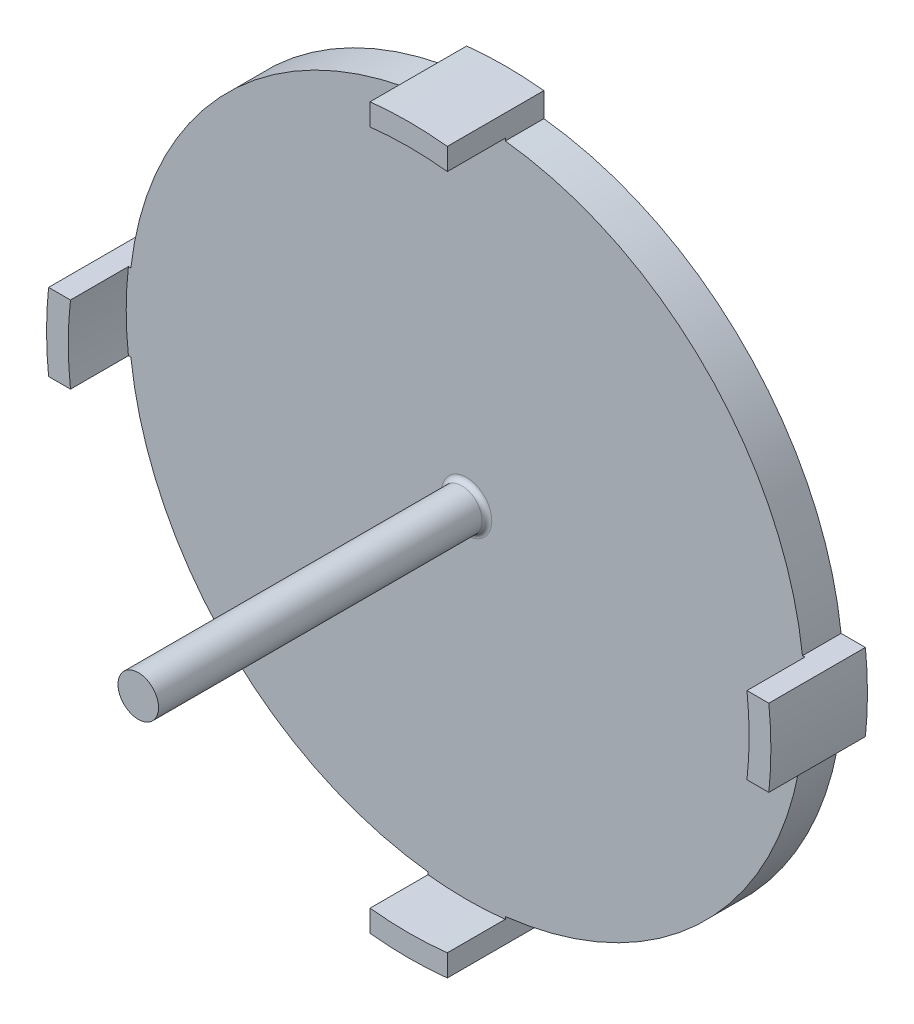
from build123d import *

# Parameters (mm, degrees)
BOSS_EXTRUDE1_DEPTH   = 10
BOSS_EXTRUDE1_2_DEPTH = 10
BOSS_EXTRUDE1_3_DEPTH = 10
BOSS_EXTRUDE1_4_DEPTH = 10
BOSS_EXTRUDE2_DEPTH   = 4
SKETCH3_R             = 2.1
BOSS_EXTRUDE3_DEPTH   = 34
FILLET1_R             = 0.5


with BuildPart() as part:
    # Sketch1 → Boss-Extrude1 (new body)
    with BuildSketch(Plane.XY):
        with BuildLine():
            ThreePointArc((37.286056375, -4), (37.5, 0), (37.286056375, 4))
            Line((37.286056375, 4), (35.022314315, 4))
            ThreePointArc((35.022314315, 4), (35.25, 0), (35.022314315, -4))
            Line((35.022314315, -4), (37.286056375, -4))
        make_face()
    extrude(amount=BOSS_EXTRUDE1_DEPTH)



with BuildPart() as body_2:
    # Sketch1 → Boss-Extrude1 2 (new body)
    with BuildSketch(Plane.XY):
        with BuildLine():
            ThreePointArc((-4, 35.022314315), (0, 35.25), (4, 35.022314315))
            Line((4, 35.022314315), (4, 37.286056375))
            ThreePointArc((4, 37.286056375), (0, 37.5), (-4, 37.286056375))
            Line((-4, 37.286056375), (-4, 35.022314315))
        make_face()
    extrude(amount=BOSS_EXTRUDE1_2_DEPTH)


with BuildPart() as body_3:
    # Sketch1 → Boss-Extrude1 3 (new body)
    with BuildSketch(Plane.XY):
        with BuildLine():
            Line((4, -37.286056375), (4, -35.022314315))
            ThreePointArc((4, -35.022314315), (0, -35.25), (-4, -35.022314315))
            Line((-4, -35.022314315), (-4, -37.286056375))
            ThreePointArc((-4, -37.286056375), (0, -37.5), (4, -37.286056375))
        make_face()
    extrude(amount=BOSS_EXTRUDE1_3_DEPTH)


with BuildPart() as body_4:
    # Sketch1 → Boss-Extrude1 4 (new body)
    with BuildSketch(Plane.XY):
        with BuildLine():
            ThreePointArc((-35.022314315, -4), (-35.25, 0), (-35.022314315, 4))
            Line((-35.022314315, 4), (-37.286056375, 4))
            ThreePointArc((-37.286056375, 4), (-37.5, 0), (-37.286056375, -4))
            Line((-37.286056375, -4), (-35.022314315, -4))
        make_face()
    extrude(amount=BOSS_EXTRUDE1_4_DEPTH)


with BuildPart() as part_1:
    add(part.part)

    add(body_2.part)  # Boss-Extrude2 merges body 2

    add(body_3.part)  # Boss-Extrude2 merges body 3

    add(body_4.part)  # Boss-Extrude2 merges body 4
    # Sketch1<3> → Boss-Extrude2 (add)
    with BuildSketch(Plane.XY):
        with BuildLine():
            ThreePointArc((35.022314315, -4), (35.25, 0), (35.022314315, 4))
            Line((35.022314315, 4), (34.770677301, 4))
            ThreePointArc((34.770677301, 4), (24.748737342, 24.748737342), (4, 34.770677301))
            Line((4, 34.770677301), (4, 35.022314315))
            ThreePointArc((4, 35.022314315), (0, 35.25), (-4, 35.022314315))
            Line((-4, 35.022314315), (-4, 34.770677301))
            ThreePointArc((-4, 34.770677301), (-24.748737342, 24.748737342), (-34.770677301, 4))
            Line((-34.770677301, 4), (-35.022314315, 4))
            ThreePointArc((-35.022314315, 4), (-35.25, 0), (-35.022314315, -4))
            Line((-35.022314315, -4), (-34.770677301, -4))
            ThreePointArc((-34.770677301, -4), (-24.748737342, -24.748737342), (-4, -34.770677301))
            Line((-4, -34.770677301), (-4, -35.022314315))
            ThreePointArc((-4, -35.022314315), (0, -35.25), (4, -35.022314315))
            Line((4, -35.022314315), (4, -34.770677301))
            ThreePointArc((4, -34.770677301), (24.748737342, -24.748737342), (34.770677301, -4))
            Line((34.770677301, -4), (35.022314315, -4))
        make_face()
    extrude(amount=BOSS_EXTRUDE2_DEPTH)

    # Sketch3 → Boss-Extrude3 (add)
    with BuildSketch(Plane.XY.offset(4)):
        Circle(SKETCH3_R)
    extrude(amount=BOSS_EXTRUDE3_DEPTH)

    # Fillet1
    fillet1_edges = [part_1.edges().sort_by_distance(p)[0] for p in [
        (-2.1, 0, 4),
    ]]
    fillet(fillet1_edges, radius=FILLET1_R)


solid = part_1.part
